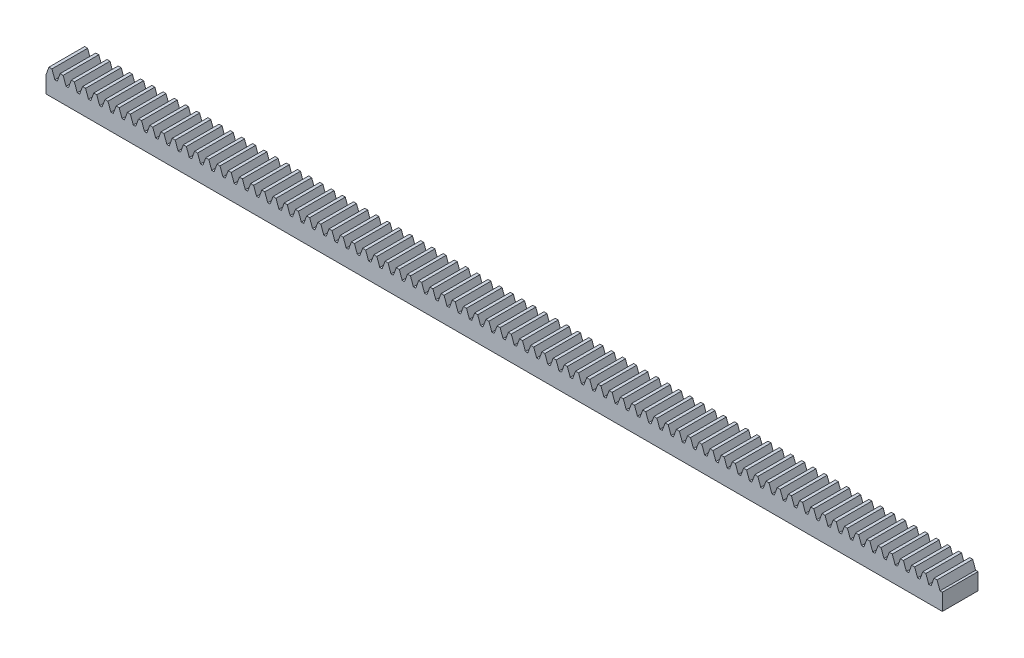
from build123d import *

# Parameters (mm, degrees)
SKETCH_1_W             = 502.654824574
SKETCH_1_H             = 9.35
EXTRUDE_1_DEPTH        = 20
EXTRUDE_2_DEPTH        = 20
PATTERN_LINEAR_1_COUNT = 80
PATTERN_LINEAR_1_PITCH = 6.283185307


with BuildPart() as part:
    # 草图1 → 拉伸1 (new body)
    with BuildSketch(Plane.XY):
        with Locations((251.327412287, -4.675)):
            Rectangle(SKETCH_1_W, SKETCH_1_H)
    extrude(amount=EXTRUDE_1_DEPTH)

    # 草图2 → 拉伸2 (add)
    with BuildSketch(Plane.XY.offset(20)):
        Polygon((0, 0), (1.637866054, 4.5), (3.323577771, 4.5), (4.961443825, 0), align=None)
    extrude_2 = extrude(amount=-EXTRUDE_2_DEPTH)

    # 阵列(线性)1: 拉伸2 ×80
    with Locations(*[(i * PATTERN_LINEAR_1_PITCH, 0, 0) for i in range(1, PATTERN_LINEAR_1_COUNT)]):
        add(extrude_2)


solid = part.part
